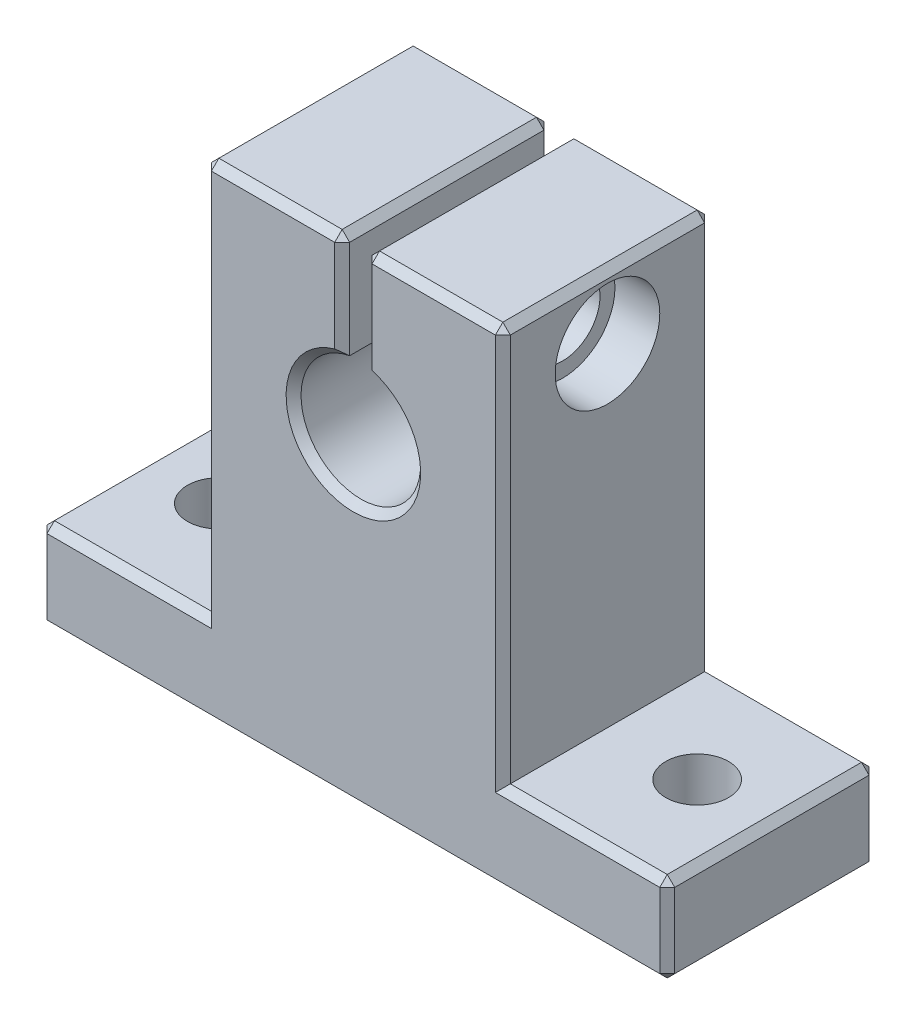
from build123d import *

# Parameters (mm, degrees)
BODY_DEPTH              = 7
SKETCH2_R               = 2.5
BOLT_CLEARANCE_DEPTH    = 31.858548248
SKETCH3_R               = 3.5
BOLT_HEAD_SEATING_DEPTH = 3
CLAMPING_HOLE_M4X0_7_D  = 3.3
MOUNTING_HOLE_M5X0_8_D  = 4.2
CHAMFER_2_SIZE          = 0.5


with BuildPart() as part:
    # Sketch1 → Body (new, symmetric)
    with BuildSketch(Plane.XY):
        with BuildLine():
            Line((-10, 11), (-0.75, 11))
            Line((-0.75, 11), (-0.75, 3.929058411))
            ThreePointArc((-0.75, 3.929058411), (0, -4), (0.75, 3.929058411))
            Line((0.75, 3.929058411), (0.75, 11))
            Line((0.75, 11), (10, 11))
            Line((10, 11), (10, -15.5))
            Line((10, -15.5), (21, -15.5))
            Line((21, -15.5), (21, -21.5))
            Line((21, -21.5), (-21, -21.5))
            Line((-21, -21.5), (-21, -15.5))
            Line((-21, -15.5), (-10, -15.5))
            Line((-10, -15.5), (-10, 11))
        make_face()
    extrude(amount=BODY_DEPTH, both=True)

    # Sketch2 → Bolt Clearance (cut, through all)
    with BuildSketch(Plane(origin=(0, 0, 0), x_dir=(0, 0, -1), z_dir=(1, 0, 0))):
        with Locations((0, 6.75)):
            Circle(SKETCH2_R)
    extrude(amount=BOLT_CLEARANCE_DEPTH, mode=Mode.SUBTRACT)

    # Sketch3 → Bolt Head Seating (cut)
    with BuildSketch(Plane(origin=(10, 0, 0), x_dir=(0, 0, -1), z_dir=(1, 0, 0))):
        with Locations((0, 6.75)):
            Circle(SKETCH3_R)
    extrude(amount=-BOLT_HEAD_SEATING_DEPTH, mode=Mode.SUBTRACT)

    # Clamping Hole (M4x0.7) (through all)
    with Locations(Plane(origin=(-0.75, 6.75, 0), x_dir=(0, 1, 0), z_dir=(1, 0, 0))):
        with Locations((0, 0)):
            Hole(CLAMPING_HOLE_M4X0_7_D / 2)

    # Mounting Hole (M5x0.8) (through all)
    with Locations(Plane(origin=(-16, -15.5, 0), x_dir=(0, 0, 1), z_dir=(0, 1, 0))):
        with Locations((0, 0), (0, 32)):
            Hole(MOUNTING_HOLE_M5X0_8_D / 2)

    # Chamfer 2
    chamfer_2_edges = [part.edges().sort_by_distance(p)[0] for p in [
        (21, -21.5, 0),
        (21, -15.5, 0),
        (-21, -15.5, 0),
        (-21, -21.5, 0),
        (10, 11, 0),
        (0.75, 11, 0),
        (-0.75, 11, 0),
        (-15.5, -15.5, -7),
        (-21, -18.5, -7),
        (0, -21.5, -7),
        (21, -18.5, -7),
        (15.5, -15.5, -7),
        (10, -2.25, -7),
        (5.375, 11, -7),
        (0.75, 7.464529206, -7),
        (0, -4, -7),
        (-0.75, 7.464529206, -7),
        (-5.375, 11, -7),
        (-10, -2.25, -7),
        (-10, 11, 0),
        (-5.375, 11, 7),
        (-0.75, 7.464529206, 7),
        (0, -4, 7),
        (0.75, 7.464529206, 7),
        (5.375, 11, 7),
        (10, -2.25, 7),
        (15.5, -15.5, 7),
        (21, -18.5, 7),
        (0, -21.5, 7),
        (-21, -18.5, 7),
        (-15.5, -15.5, 7),
        (-10, -2.25, 7),
    ]]
    chamfer(chamfer_2_edges, length=CHAMFER_2_SIZE)


solid = part.part
